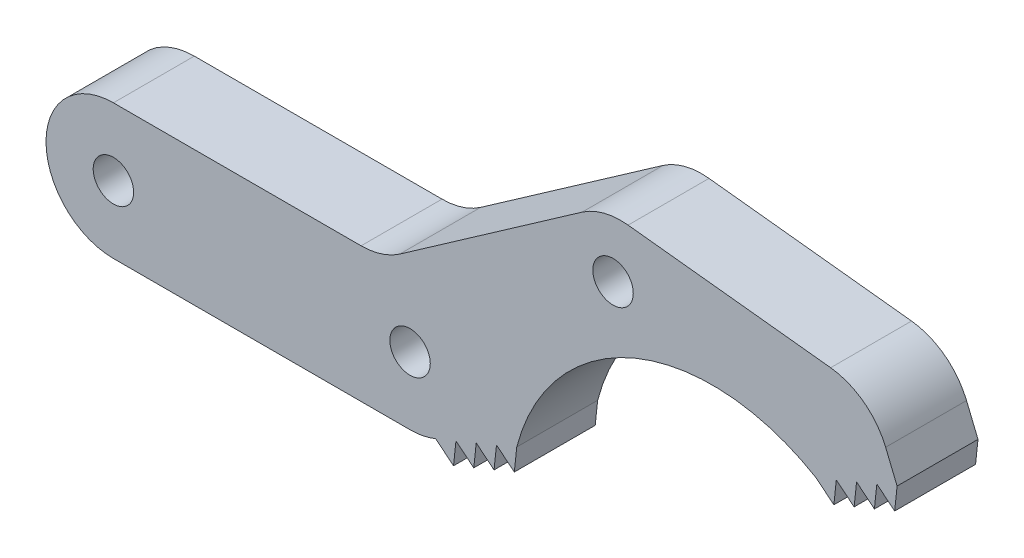
from build123d import *

# Parameters (mm, degrees)
SKETCH1_R           = 1.5
BOSS_EXTRUDE1_DEPTH = 6
FILLET2_R           = 5


with BuildPart() as part:
    # Sketch1 → Boss-Extrude1 (new body)
    with BuildSketch(Plane.XY):
        with BuildLine():
            Line((19.944251464, 5), (0, 5))
            ThreePointArc((0, 5), (-5, 0), (0, -5))
            Line((0, -5), (22, -5))
            ThreePointArc((22, -5), (22.969031552, -4.905199063), (23.901317064, -4.624391141))
            Line((23.901317064, -4.624391141), (25.223175743, -5.70274446))
            Line((25.223175743, -5.70274446), (25.404244184, -4.006463095))
            Line((25.404244184, -4.006463095), (26.726102864, -5.084816415))
            Line((26.726102864, -5.084816415), (26.907171305, -3.388535049))
            Line((26.907171305, -3.388535049), (28.229029985, -4.466888369))
            Line((28.229029985, -4.466888369), (28.410098426, -2.770607004))
            Line((28.410098426, -2.770607004), (29.731957105, -3.848960323))
            Line((29.731957105, -3.848960323), (29.913025547, -2.152678958))
            ThreePointArc((29.913025547, -2.152678958), (38.729983808, 7.959751364), (52.110103023, 6.973642948))
            Line((52.110103023, 6.973642948), (53.431961702, 5.895289628))
            Line((53.431961702, 5.895289628), (53.613030144, 7.591570993))
            Line((53.613030144, 7.591570993), (54.934888823, 6.513217674))
            Line((54.934888823, 6.513217674), (55.115957264, 8.209499039))
            Line((55.115957264, 8.209499039), (56.437815944, 7.13114572))
            Line((56.437815944, 7.13114572), (56.618884385, 8.827427085))
            Line((56.618884385, 8.827427085), (57.940743065, 7.749073765))
            Line((57.940743065, 7.749073765), (58.121811506, 9.44535513))
            Line((58.121811506, 9.44535513), (56.143278706, 14.257550701))
            Line((56.143278706, 14.257550701), (36.302637348, 16.436961709))
            Line((36.302637348, 16.436961709), (19.944251464, 5))
        make_face()
        Circle(SKETCH1_R, mode=Mode.SUBTRACT)
        with Locations((22, 0)):
            Circle(SKETCH1_R, mode=Mode.SUBTRACT)
        with Locations((37.054498685, 12.034873136)):
            Circle(SKETCH1_R, mode=Mode.SUBTRACT)
    extrude(amount=BOSS_EXTRUDE1_DEPTH)

    # Fillet2
    fillet2_edges = [part.edges().sort_by_distance(p)[0] for p in [
        (19.944251464, 5, 3),
        (36.302637348, 16.436961709, 3),
        (56.143278706, 14.257550701, 3),
    ]]
    fillet(fillet2_edges, radius=FILLET2_R)


solid = part.part
